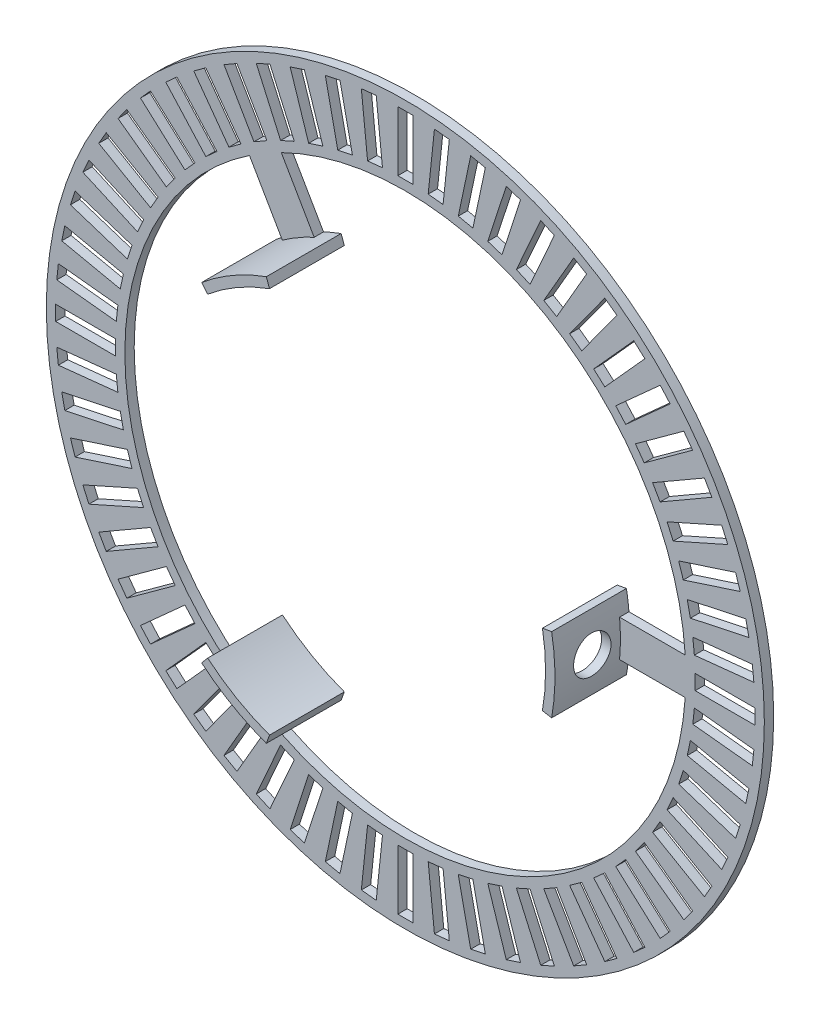
from build123d import *

# Parameters (mm, degrees)
SKETCH1_R             = 60.96
SKETCH1_R_2           = 47.625
BOSS_EXTRUDE1_DEPTH   = 1.5875
SKETCH4_W             = 2.54
SKETCH4_H             = 10.16
CUT_EXTRUDE3_DEPTH    = 5.08
CIRPATTERN2_COUNT     = 60
BOSS_EXTRUDE2_DEPTH   = 12.7
BOSS_EXTRUDE2_2_DEPTH = 12.7
BOSS_EXTRUDE2_3_DEPTH = 12.7
SKETCH12_W            = 12.270762411
SKETCH12_H            = 6.24390352
BOSS_EXTRUDE4_DEPTH   = 1.5875
SKETCH13_R            = 3.175
CUT_EXTRUDE6_DEPTH    = 88.140881336


with BuildPart() as part:
    # Sketch1 → Boss-Extrude1 (new body)
    with BuildSketch(Plane.XY):
        Circle(SKETCH1_R)
        Circle(SKETCH1_R_2, mode=Mode.SUBTRACT)
    extrude(amount=BOSS_EXTRUDE1_DEPTH)

    # Sketch4 → Cut-Extrude3 (cut)
    with BuildSketch(Plane.XY.offset(1.5875)):
        with Locations((0, 54.2925)):
            Rectangle(SKETCH4_W, SKETCH4_H)
    cut_extrude3 = extrude(amount=-CUT_EXTRUDE3_DEPTH, mode=Mode.SUBTRACT)

    # CirPattern2: Cut-Extrude3 ×60 about axis
    cirpattern2_axis = Axis((0, 0, 0), (0, 0, 1))
    for i in range(1, CIRPATTERN2_COUNT):
        add(cut_extrude3.rotate(cirpattern2_axis, i * 360 / CIRPATTERN2_COUNT), mode=Mode.SUBTRACT)



with BuildPart() as body_2:
    # Sketch10 → Boss-Extrude2 (new body)
    with BuildSketch(Plane.XY):
        with BuildLine():
            Line((34.394410774, 6.064662605), (35.957793082, 6.340329087))
            ThreePointArc((35.957793082, 6.340329087), (36.5125, 0), (35.957793082, -6.340329087))
            Line((35.957793082, -6.340329087), (34.394410774, -6.064662605))
            ThreePointArc((34.394410774, -6.064662605), (34.925, 0), (34.394410774, 6.064662605))
        make_face()
    extrude(amount=BOSS_EXTRUDE2_DEPTH)


with BuildPart() as body_3:
    # Sketch10 → Boss-Extrude2 2 (new body)
    with BuildSketch(Plane.XY):
        with BuildLine():
            Line((-11.945053506, -32.818764781), (-12.488010483, -34.310526816))
            ThreePointArc((-12.488010483, -34.310526816), (-18.25625, -31.620752556), (-23.469782599, -27.970197729))
            Line((-23.469782599, -27.970197729), (-22.449357268, -26.754102176))
            ThreePointArc((-22.449357268, -26.754102176), (-17.4625, -30.245937227), (-11.945053506, -32.818764781))
        make_face()
    extrude(amount=BOSS_EXTRUDE2_2_DEPTH)


with BuildPart() as body_4:
    # Sketch10 → Boss-Extrude2 3 (new body)
    with BuildSketch(Plane.XY):
        with BuildLine():
            Line((-22.449357268, 26.754102176), (-23.469782599, 27.970197729))
            ThreePointArc((-23.469782599, 27.970197729), (-18.25625, 31.620752556), (-12.488010483, 34.310526816))
            Line((-12.488010483, 34.310526816), (-11.945053506, 32.818764781))
            ThreePointArc((-11.945053506, 32.818764781), (-17.4625, 30.245937227), (-22.449357268, 26.754102176))
        make_face()
    extrude(amount=BOSS_EXTRUDE2_3_DEPTH)


with BuildPart() as part_1:
    add(part.part)

    add(body_2.part)  # Boss-Extrude4 merges body 2
    # Sketch12 → Boss-Extrude4 (add)
    with BuildSketch(Plane.XY):
        Polygon((-20.663294506, -29.545972416), (-26.798675712, -40.172764388), (-21.391296644, -43.294716148), (-15.255915439, -32.667924177), align=None)
        with Locations((42.054591151, 0)):
            Rectangle(SKETCH12_W, SKETCH12_H)
        Polygon((-15.255915439, 32.667924177), (-21.391296644, 43.294716148), (-26.798675712, 40.172764388), (-20.663294506, 29.545972416), align=None)
    extrude(amount=BOSS_EXTRUDE4_DEPTH)

    # Sketch13 → Cut-Extrude6 (cut, through all)
    with BuildSketch(Plane(origin=(0, 0, 0), x_dir=(0, 0, -1), z_dir=(1, 0, 0))):
        with Locations(Location((-6.35, 0, 0), (0, 0, 180))):
            Circle(SKETCH13_R)
    extrude(amount=CUT_EXTRUDE6_DEPTH, mode=Mode.SUBTRACT)


solid = Compound([body_3.part, body_4.part, part_1.part])
